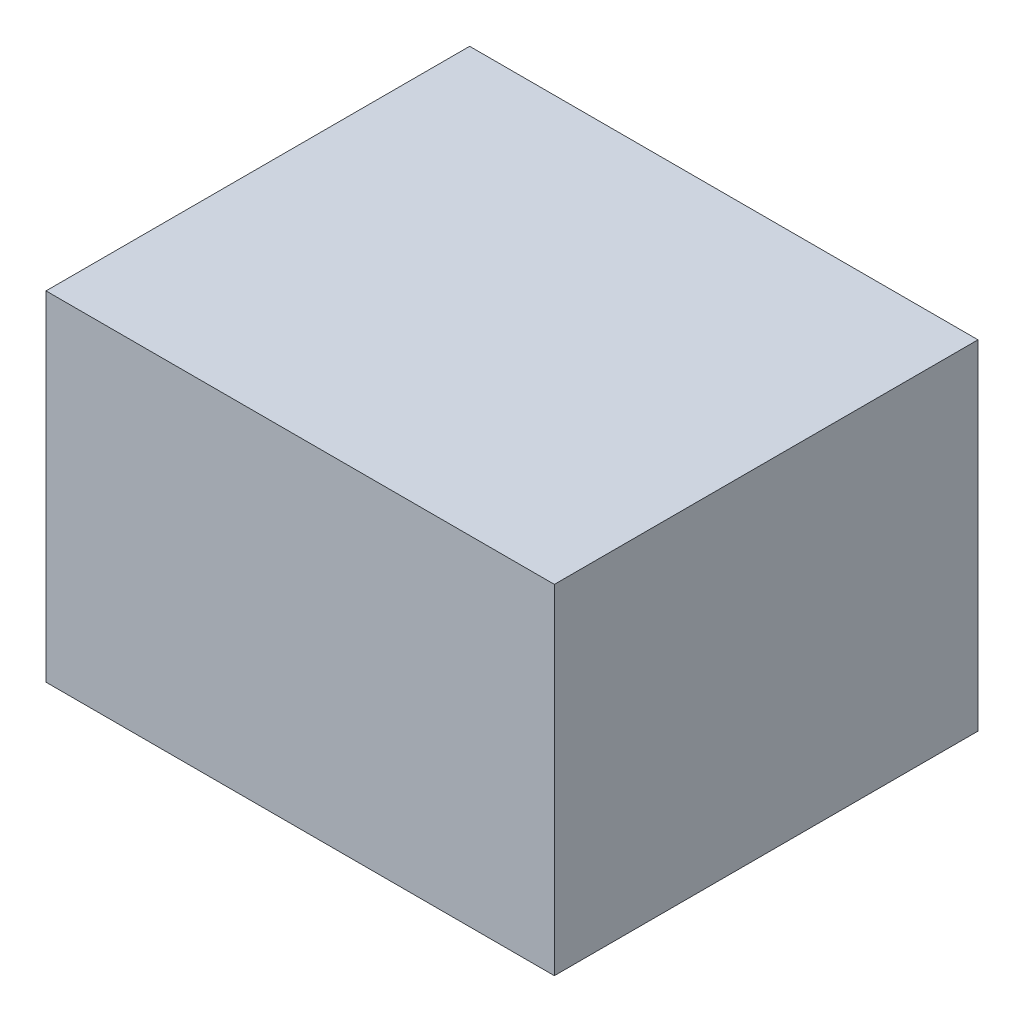
from build123d import *

# Parameters (mm, degrees)
SKETCH1_W           = 120
SKETCH1_H           = 100
BOSS_EXTRUDE1_DEPTH = 80


with BuildPart() as part:
    # Sketch1 → Boss-Extrude1 (new body)
    with BuildSketch(Plane(origin=(0, 0, 0), x_dir=(1, 0, 0), z_dir=(0, 1, 0))):
        Rectangle(SKETCH1_W, SKETCH1_H)
    extrude(amount=BOSS_EXTRUDE1_DEPTH)


solid = part.part
